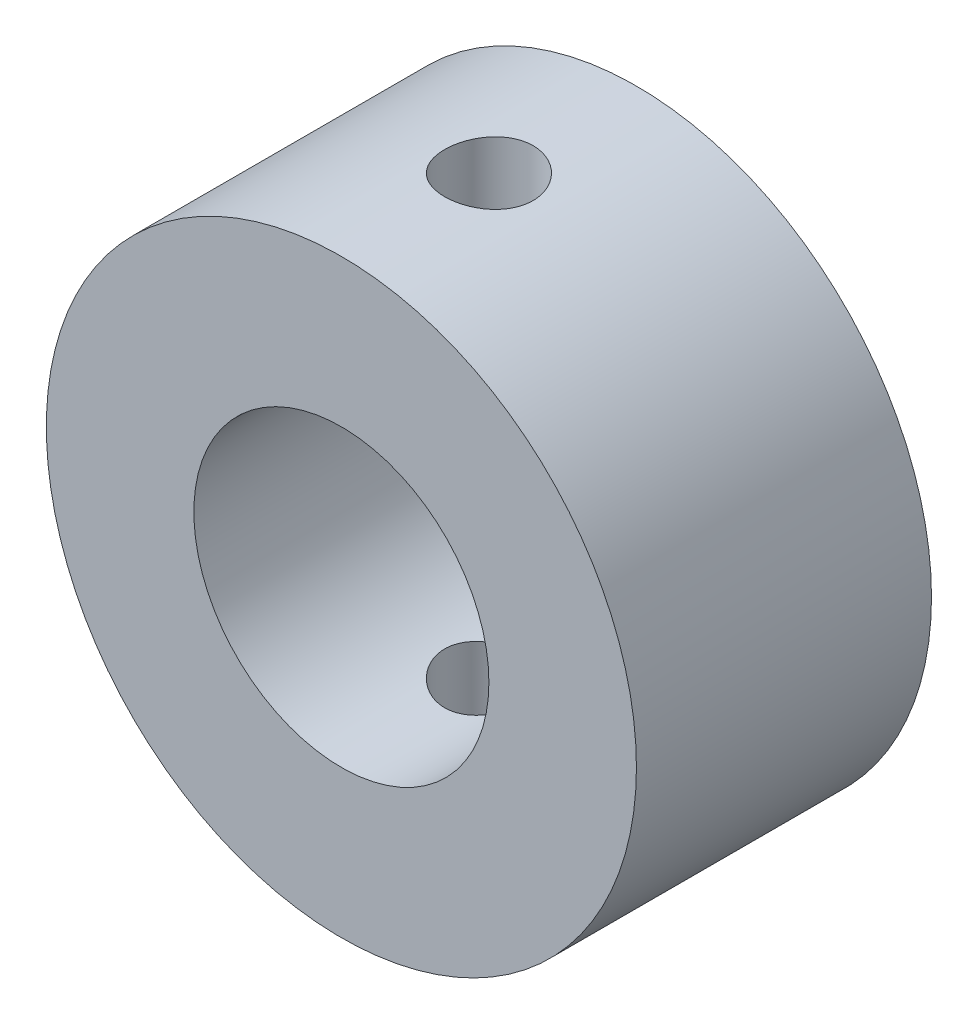
from build123d import *

# Parameters (mm, degrees)
SKETCH1_R           = 20
SKETCH1_R_2         = 10
BOSS_EXTRUDE1_DEPTH = 20
SKETCH2_R           = 3
CUT_EXTRUDE1_DEPTH  = 28


with BuildPart() as part:
    # Sketch1 → Boss-Extrude1 (new body)
    with BuildSketch(Plane.XY):
        Circle(SKETCH1_R)
        Circle(SKETCH1_R_2, mode=Mode.SUBTRACT)
    extrude(amount=BOSS_EXTRUDE1_DEPTH)

    # Sketch2 → Cut-Extrude1 (cut, symmetric)
    with BuildSketch(Plane(origin=(0, 0, 0), x_dir=(1, 0, 0), z_dir=(0, 1, 0))):
        with Locations(Location((0, -10, 0), (0, 0, 270))):
            Circle(SKETCH2_R)
    extrude(amount=CUT_EXTRUDE1_DEPTH, both=True, mode=Mode.SUBTRACT)


solid = part.part
